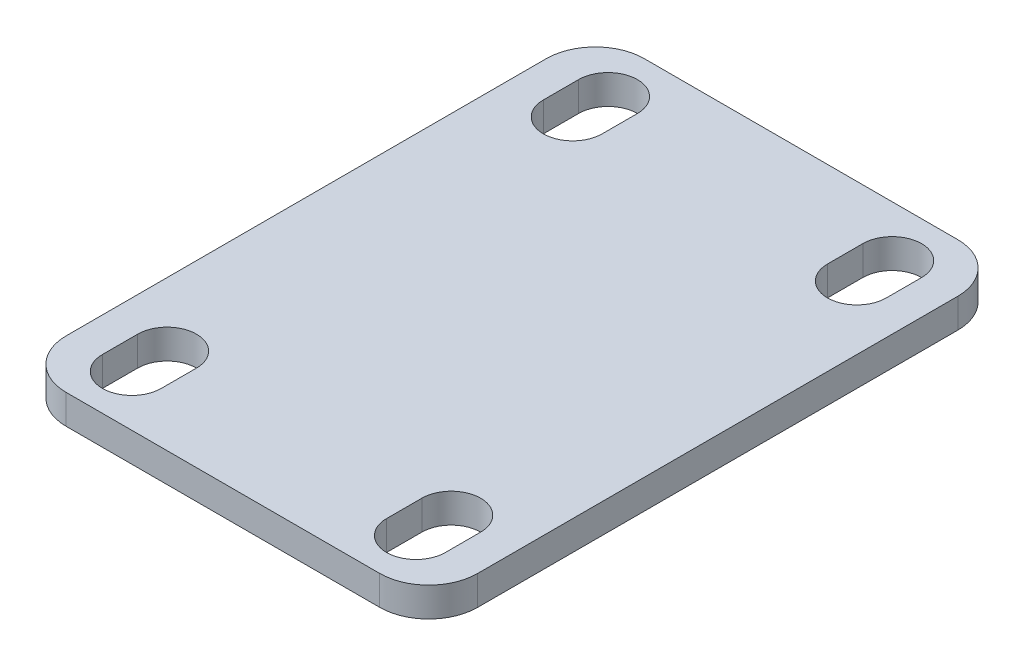
from build123d import *

# Parameters (mm, degrees)
EXTRUDE_1_DEPTH = 3
SKETCH_2_R      = 17.5
EXTRUDE_2_DEPTH = 3


with BuildPart() as part:
    # 草图1 → 凸台-拉伸1 (new body)
    with BuildSketch(Plane(origin=(0, 0, 0), x_dir=(1, 0, 0), z_dir=(0, 1, 0))):
        with BuildLine():
            Line((16, -29.5), (-16, -29.5))
            ThreePointArc((-16, -29.5), (-19.535533906, -28.035533906), (-21, -24.5))
            Line((-21, -24.5), (-21, 24.5))
            ThreePointArc((-21, 24.5), (-19.535533906, 28.035533906), (-16, 29.5))
            Line((-16, 29.5), (16, 29.5))
            ThreePointArc((16, 29.5), (19.535533906, 28.035533906), (21, 24.5))
            Line((21, 24.5), (21, -24.5))
            ThreePointArc((21, -24.5), (19.535533906, -28.035533906), (16, -29.5))
        make_face()
        with BuildLine():
            Line((-11.5, 24.3), (-11.5, 20.7))
            ThreePointArc((-11.5, 20.7), (-14.5, 17.7), (-17.5, 20.7))
            Line((-17.5, 20.7), (-17.5, 24.3))
            ThreePointArc((-17.5, 24.3), (-14.5, 27.3), (-11.5, 24.3))
        make_face(mode=Mode.SUBTRACT)
        with BuildLine():
            Line((11.5, 24.3), (11.5, 20.7))
            ThreePointArc((11.5, 20.7), (14.5, 17.7), (17.5, 20.7))
            Line((17.5, 20.7), (17.5, 24.3))
            ThreePointArc((17.5, 24.3), (14.5, 27.3), (11.5, 24.3))
        make_face(mode=Mode.SUBTRACT)
        with BuildLine():
            Line((-11.5, -24.3), (-11.5, -20.7))
            ThreePointArc((-11.5, -20.7), (-14.5, -17.7), (-17.5, -20.7))
            Line((-17.5, -20.7), (-17.5, -24.3))
            ThreePointArc((-17.5, -24.3), (-14.5, -27.3), (-11.5, -24.3))
        make_face(mode=Mode.SUBTRACT)
        with BuildLine():
            Line((11.5, -24.3), (11.5, -20.7))
            ThreePointArc((11.5, -20.7), (14.5, -17.7), (17.5, -20.7))
            Line((17.5, -20.7), (17.5, -24.3))
            ThreePointArc((17.5, -24.3), (14.5, -27.3), (11.5, -24.3))
        make_face(mode=Mode.SUBTRACT)
    extrude(amount=EXTRUDE_1_DEPTH)

    # 草图2 → 凸台-拉伸2 (add)
    with BuildSketch(Plane.XZ):
        with Locations(Location((0, 0, 0), (0, 0, 90))):
            Circle(SKETCH_2_R)
    extrude(amount=EXTRUDE_2_DEPTH)


solid = part.part
